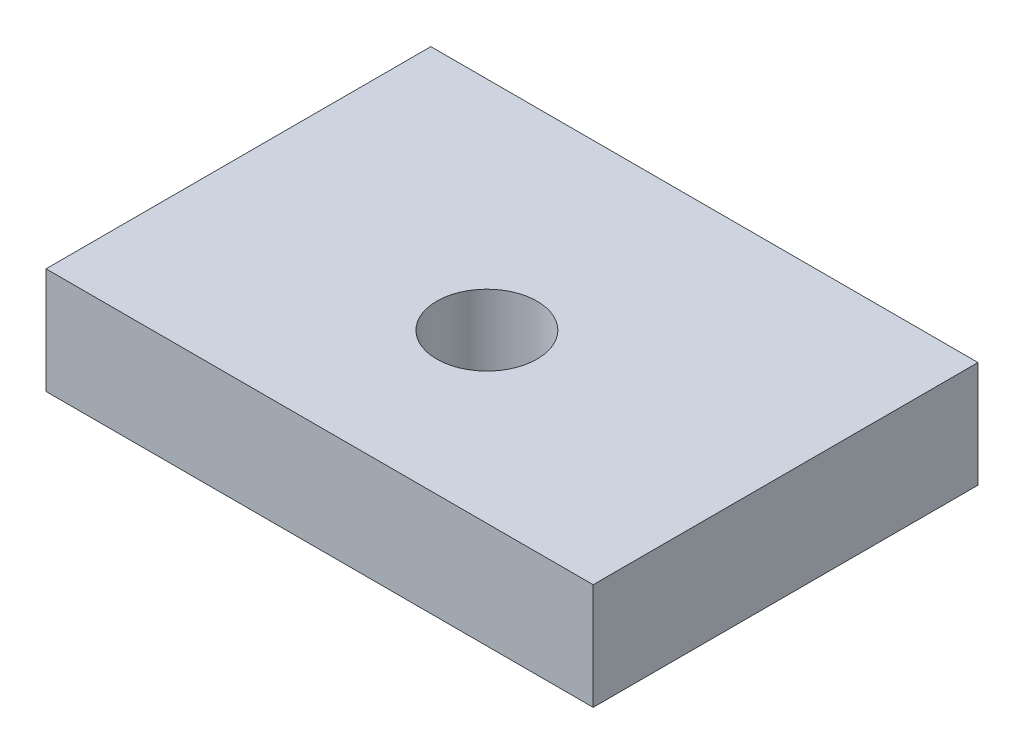
from build123d import *

# Parameters (mm, degrees)
SKETCH1_W           = 32.7
SKETCH1_H           = 23
SKETCH1_R           = 3
BOSS_EXTRUDE1_DEPTH = 3.175


with BuildPart() as part:
    # Sketch1 → Boss-Extrude1 (new, symmetric)
    with BuildSketch(Plane(origin=(0, 0, 0), x_dir=(1, 0, 0), z_dir=(0, 1, 0))):
        with Locations((0, 1.5)):
            Rectangle(SKETCH1_W, SKETCH1_H)
        with Locations(Location((0, 0, 0), (0, 0, 270))):
            Circle(SKETCH1_R, mode=Mode.SUBTRACT)
    extrude(amount=BOSS_EXTRUDE1_DEPTH, both=True)


solid = part.part
